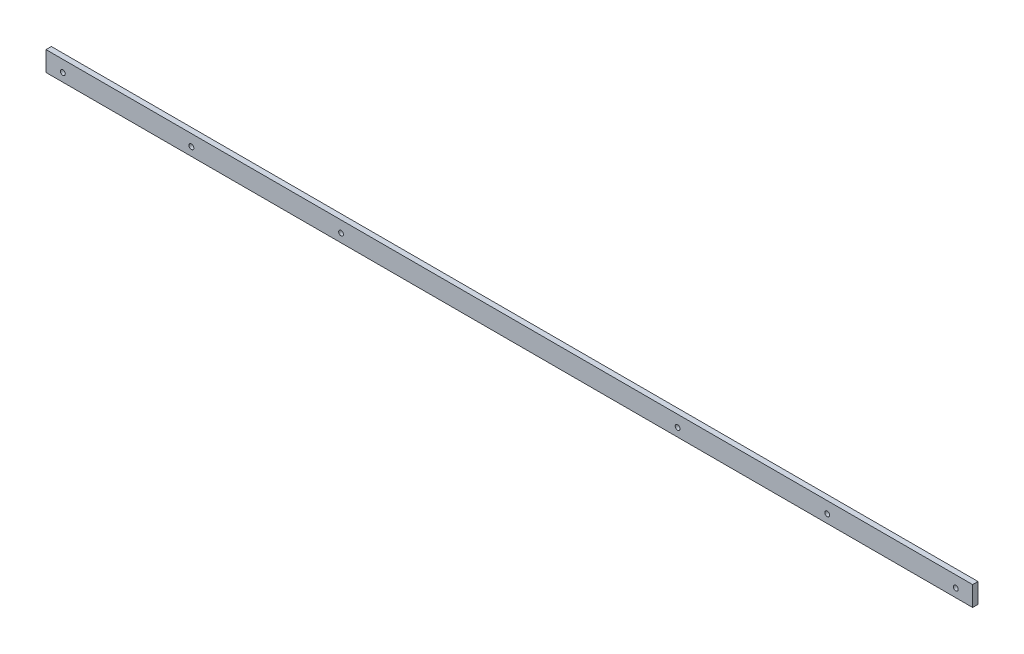
from build123d import *

# Parameters (mm, degrees)
SKETCH1_W           = 550.7
SKETCH1_H           = 11.8
BOSS_EXTRUDE1_DEPTH = 3.18
CUT_EXTRUDE2_REACH  = 277.432
SKETCH3_R           = 1.425
CUT_EXTRUDE3_REACH  = 277.432
SKETCH2_R           = 1.45
CUT_EXTRUDE4_REACH  = 277.432
SKETCH4_R           = 1.45


with BuildPart() as part:
    # Sketch1 → Boss-Extrude1 (new body)
    with BuildSketch(Plane.XY):
        Rectangle(SKETCH1_W, SKETCH1_H)
    extrude(amount=BOSS_EXTRUDE1_DEPTH)

    # Sketch3 → Cut-Extrude2 (cut, up to next)
    with BuildSketch(Plane.XY.offset(3.18), mode=Mode.PRIVATE) as cut_extrude2_sk1:
        with Locations((100, -0.9)):
            Circle(SKETCH3_R)
    cut_extrude2_tool1 = extrude(cut_extrude2_sk1.sketch, amount=-CUT_EXTRUDE2_REACH, mode=Mode.PRIVATE) & part.part
    cut_extrude2 = cut_extrude2_tool1.solids().sort_by_distance((100, -0.9, 3.18))[0]
    add(cut_extrude2, mode=Mode.SUBTRACT)

    # Mirror2: Cut-Extrude2 across plane
    add(cut_extrude2.mirror(Plane(origin=(0, 0, 0), x_dir=(0, 0, 1), z_dir=(1, 0, 0))), mode=Mode.SUBTRACT)

    # Sketch2 → Cut-Extrude3 (cut, up to next)
    with BuildSketch(Plane.XY.offset(3.18), mode=Mode.PRIVATE) as cut_extrude3_sk1:
        with Locations((265.35, -0.9)):
            Circle(SKETCH2_R)
    cut_extrude3_tool1 = extrude(cut_extrude3_sk1.sketch, amount=-CUT_EXTRUDE3_REACH, mode=Mode.PRIVATE) & part.part
    cut_extrude3 = cut_extrude3_tool1.solids().sort_by_distance((265.35, -0.9, 3.18))[0]
    add(cut_extrude3, mode=Mode.SUBTRACT)

    # Mirror3: Cut-Extrude3 across plane
    add(cut_extrude3.mirror(Plane(origin=(0, 0, 0), x_dir=(0, 0, 1), z_dir=(1, 0, 0))), mode=Mode.SUBTRACT)

    # Sketch4 → Cut-Extrude4 (cut, up to next)
    with BuildSketch(Plane.XY.offset(3.18), mode=Mode.PRIVATE) as cut_extrude4_sk1:
        with Locations((-188.94, -0.9)):
            Circle(SKETCH4_R)
    cut_extrude4_tool1 = extrude(cut_extrude4_sk1.sketch, amount=-CUT_EXTRUDE4_REACH, mode=Mode.PRIVATE) & part.part
    cut_extrude4 = cut_extrude4_tool1.solids().sort_by_distance((-188.94, -0.9, 3.18))[0]
    add(cut_extrude4, mode=Mode.SUBTRACT)

    # Mirror4: Cut-Extrude4 across plane
    add(cut_extrude4.mirror(Plane(origin=(0, 0, 0), x_dir=(0, 0, 1), z_dir=(1, 0, 0))), mode=Mode.SUBTRACT)


solid = part.part
